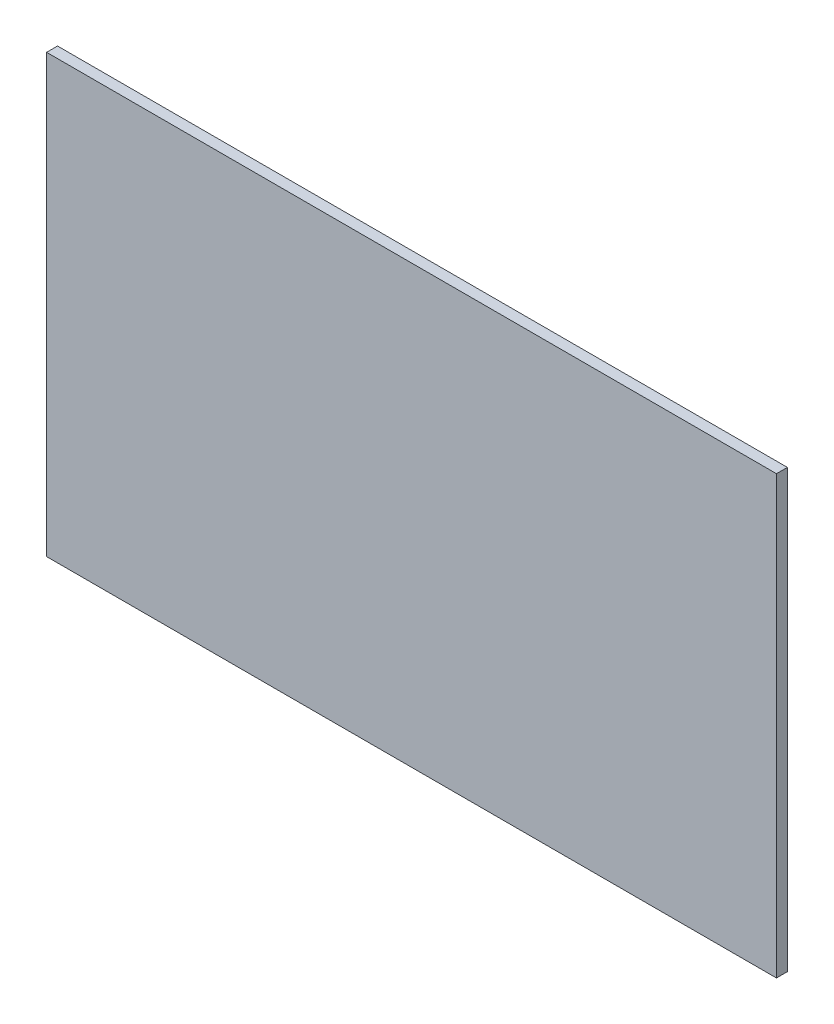
from build123d import *

# Parameters (mm, degrees)
SKETCH_1_W      = 167.117912718
SKETCH_1_H      = 2.5
EXTRUDE_1_DEPTH = 100


with BuildPart() as part:
    # Эскиз1 → Вытянуть1 (new body)
    with BuildSketch(Plane(origin=(0, 0, 0), x_dir=(1, 0, 0), z_dir=(0, 1, 0))):
        with Locations((-6.717694751, -1.25)):
            Rectangle(SKETCH_1_W, SKETCH_1_H)
    extrude(amount=EXTRUDE_1_DEPTH)


solid = part.part
